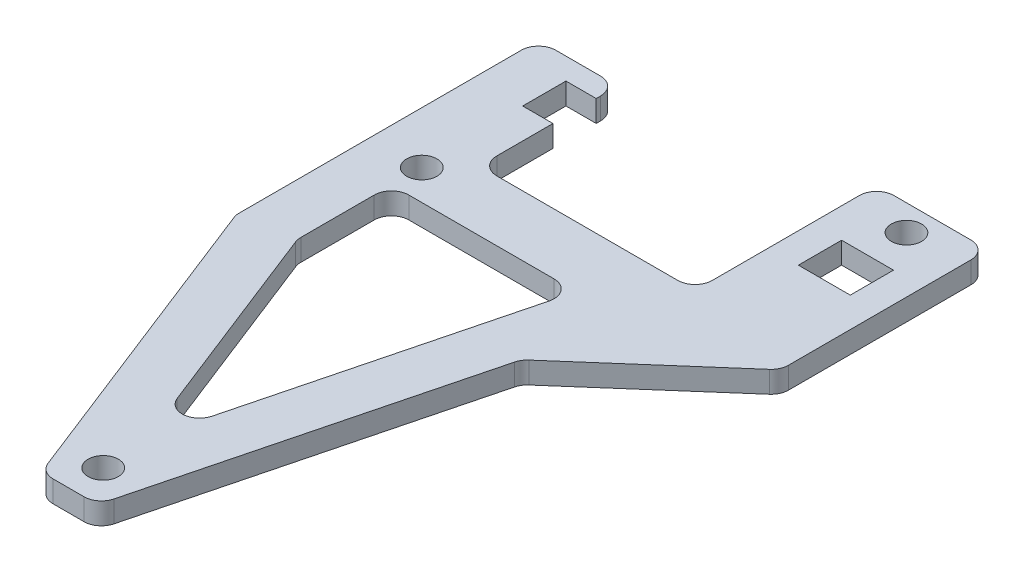
from build123d import *

# Parameters (mm, degrees)
BOSS_EXTRUDE1_DEPTH = 1.25
FILLET2_R           = 2
SKETCH2_R           = 1.75
SKETCH2_W           = 6
SKETCH2_H           = 5
SKETCH2_W_2         = 3.5
CUT_EXTRUDE1_DEPTH  = 48.430298597


with BuildPart() as part:
    # Sketch1 → Boss-Extrude1 (new, symmetric)
    with BuildSketch(Plane(origin=(0, 0, 0), x_dir=(1, 0, 0), z_dir=(0, 1, 0))):
        Polygon((-21.635, 0), (-21.635, 35), (-12.465, 35), (-12.465, 19), (12.465, 19), (12.465, 40), (25.365, 40), (25.365, 16), (9.365, 2), (-0.635, -37), (-7.135, -37), align=None)
        Polygon((-15.635, 12), (5.735003444, 12), (-4.401302874, -27.531594642), (-15.635, 1.133701473), align=None, mode=Mode.SUBTRACT)
    extrude(amount=BOSS_EXTRUDE1_DEPTH, both=True)

    # Fillet2
    fillet2_edges = [part.edges().sort_by_distance(p)[0] for p in [
        (-21.635, 0, 0),
        (-21.635, 0, -35),
        (-12.465, 0, -35),
        (-12.465, 0, -19),
        (12.465, 0, -19),
        (12.465, 0, -40),
        (25.365, 0, -40),
        (25.365, 0, -16),
        (9.365, 0, -2),
        (-0.635, 0, 37),
        (-7.135, 0, 37),
        (-15.635, 0, -12),
        (-15.635, 0, -1.133701473),
        (-4.401302874, 0, 27.531594642),
        (5.735003444, 0, -12),
    ]]
    fillet(fillet2_edges, radius=FILLET2_R)

    # Sketch2 → Cut-Extrude1 (cut, through all)
    with BuildSketch(Plane(origin=(0, 1.25, 0), x_dir=(1, 0, 0), z_dir=(0, 1, 0))):
        with Locations(Location((18.915, 37, 0), (0, 0, 270))):
            Circle(SKETCH2_R)
        with Locations(Location((-15.635, 15.5, 0), (0, 0, 270))):
            Circle(SKETCH2_R)
        with Locations(Location((-3.97878342, -33, 0), (0, 0, 270))):
            Circle(SKETCH2_R)
        with Locations((18.915, 30)):
            Rectangle(SKETCH2_W, SKETCH2_H)
        with Locations((-14.215, 30)):
            Rectangle(SKETCH2_W_2, SKETCH2_H)
    extrude(amount=-CUT_EXTRUDE1_DEPTH, mode=Mode.SUBTRACT)


solid = part.part
